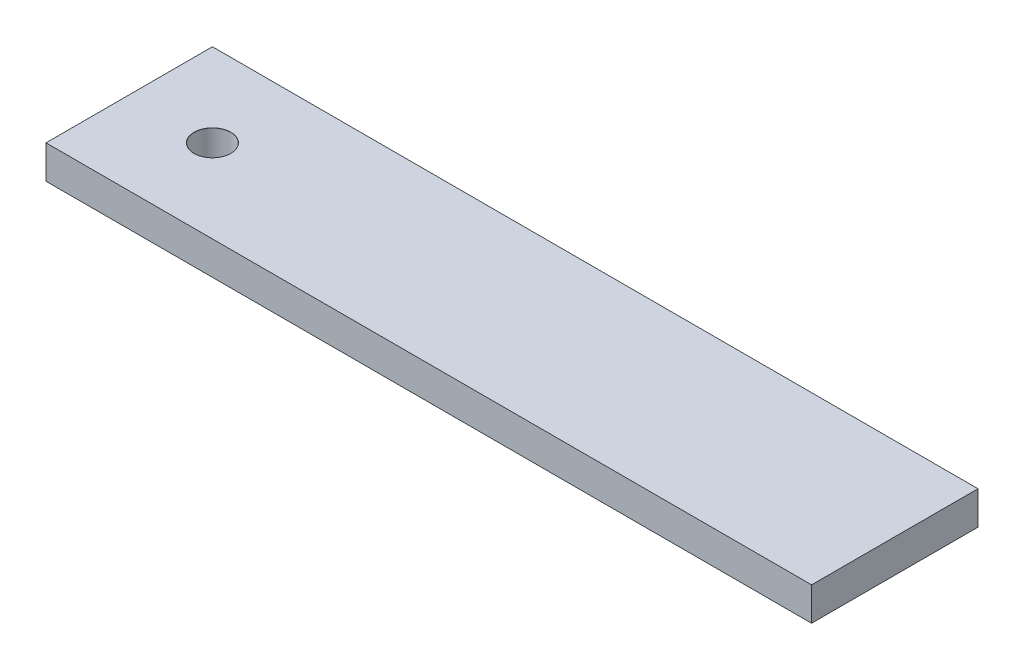
from build123d import *

# Parameters (mm, degrees)
SKETCH1_W                       = 230
SKETCH1_H                       = 50
BOSS_EXTRUDE1_DEPTH             = 10
M10_CLEARANCE_HOLE1_D           = 11
M10_CLEARANCE_HOLE1_CSINK_D     = 11.05
M10_CLEARANCE_HOLE1_CSINK_ANGLE = 90


with BuildPart() as part:
    # Sketch1 → Boss-Extrude1 (new body)
    with BuildSketch(Plane(origin=(0, 0, 0), x_dir=(1, 0, 0), z_dir=(0, 1, 0))):
        Rectangle(SKETCH1_W, SKETCH1_H)
    extrude(amount=BOSS_EXTRUDE1_DEPTH)

    # M10 Clearance Hole1 (through all)
    with Locations(Plane(origin=(0, 10, 0), x_dir=(1, 0, 0), z_dir=(0, 1, 0))):
        with Locations((-90, 0)):
            CounterSinkHole(M10_CLEARANCE_HOLE1_D / 2, M10_CLEARANCE_HOLE1_CSINK_D / 2, counter_sink_angle=M10_CLEARANCE_HOLE1_CSINK_ANGLE)


solid = part.part
